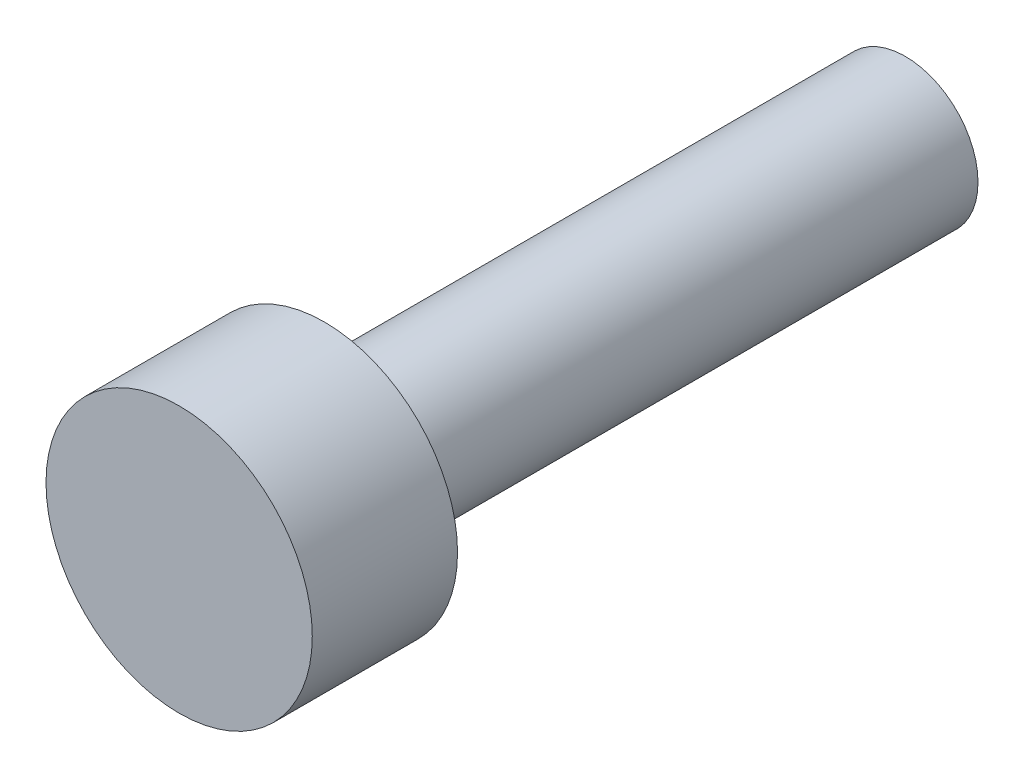
from build123d import *

# Parameters (mm, degrees)
NOMINAL_SHANK_START    = -12
SKETCH_NOMINAL_SHANK_R = 1.5
NOMINAL_SHANK_DEPTH    = 12
SKETCH_HEAD_R          = 2.75
HEAD_DEPTH             = 3


with BuildPart() as part:
    # Sketch_Nominal_shank → Nominal_shank (new body)
    with BuildSketch(Plane.XY.offset(NOMINAL_SHANK_START)):
        Circle(SKETCH_NOMINAL_SHANK_R)
    extrude(amount=NOMINAL_SHANK_DEPTH)

    # Sketch_Head → Head (add)
    with BuildSketch(Plane.XY):
        Circle(SKETCH_HEAD_R)
    extrude(amount=HEAD_DEPTH)


solid = part.part
